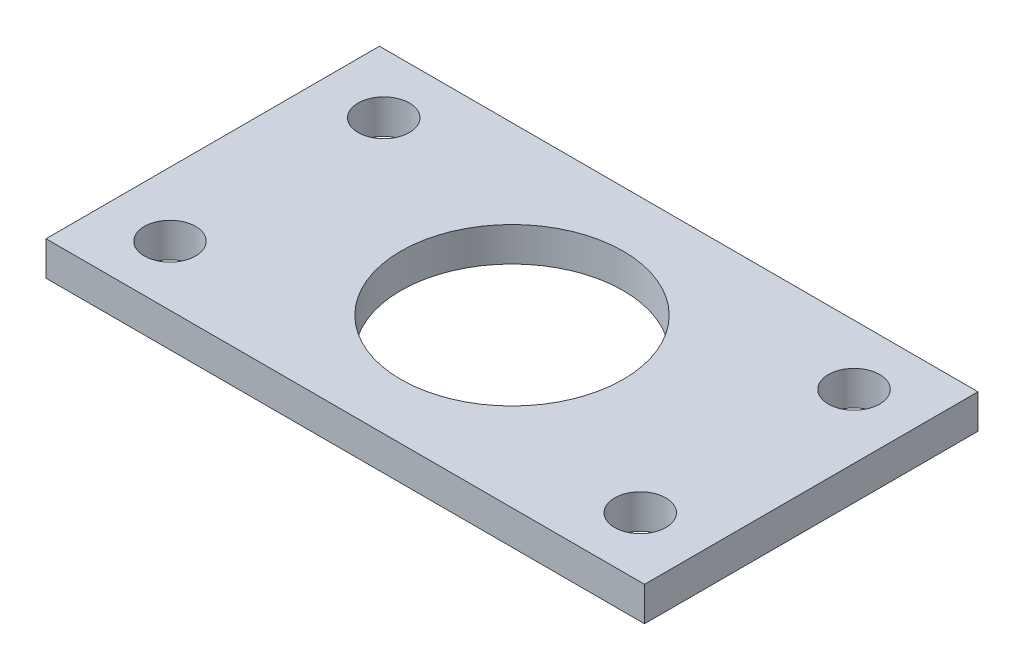
from build123d import *

# Parameters (mm, degrees)
SKETCH_1_W          = 70
SKETCH_1_H          = 4
EXTRUDE_1_DEPTH     = 39
SKETCH_2_R          = 13
SKETCH_2_R_2        = 3
CUT_EXTRUDE_1_DEPTH = 5


with BuildPart() as part:
    # 草图1 → 凸台-拉伸1 (new body)
    with BuildSketch(Plane.XY):
        with Locations((35, -2)):
            Rectangle(SKETCH_1_W, SKETCH_1_H)
    extrude(amount=EXTRUDE_1_DEPTH)

    # 草图2 → 切除-拉伸1 (cut)
    with BuildSketch(Plane(origin=(0, 0, 0), x_dir=(1, 0, 0), z_dir=(0, 1, 0))):
        with Locations(Location((35, -19.5, 0), (0, 0, 270))):
            Circle(SKETCH_2_R)
        with Locations(Location((7.5, -7, 0), (0, 0, 270))):
            Circle(SKETCH_2_R_2)
        with Locations(Location((62.5, -7, 0), (0, 0, 270))):
            Circle(SKETCH_2_R_2)
        with Locations(Location((62.5, -32, 0), (0, 0, 270))):
            Circle(SKETCH_2_R_2)
        with Locations(Location((7.5, -32, 0), (0, 0, 270))):
            Circle(SKETCH_2_R_2)
    extrude(amount=-CUT_EXTRUDE_1_DEPTH, mode=Mode.SUBTRACT)


solid = part.part
